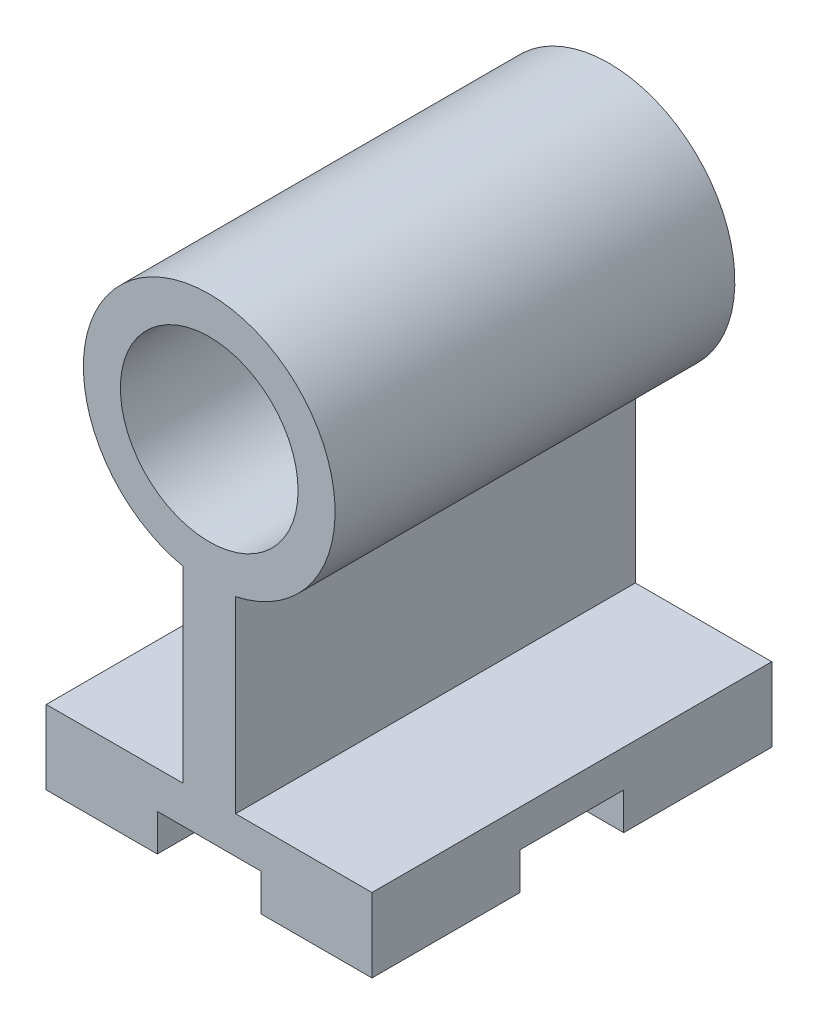
from build123d import *

# Parameters (mm, degrees)
SKETCH1_R           = 12
BOSS_EXTRUDE1_DEPTH = 54
SKETCH2_W           = 14
SKETCH2_H           = 5
CUT_EXTRUDE1_DEPTH  = 44


with BuildPart() as part:
    # Sketch1 → Boss-Extrude1 (new body)
    with BuildSketch(Plane.XY):
        with BuildLine():
            Line((-22, 0), (-7, 0))
            Line((-7, 0), (-7, 5))
            Line((-7, 5), (7, 5))
            Line((7, 5), (7, 0))
            Line((7, 0), (22, 0))
            Line((22, 0), (22, 10))
            Line((22, 10), (3.575995422, 10))
            Line((3.575995422, 10), (3.575995422, 35.405163338))
            ThreePointArc((3.575995422, 35.405163338), (0.016529647, 69.028346048), (-3.542936129, 35.405163338))
            Line((-3.542936129, 35.405163338), (-3.542936129, 10.023734162))
            Line((-3.542936129, 10.023734162), (-22, 10))
            Line((-22, 10), (-22, 0))
        make_face()
        with Locations((0.016529647, 52.028346048)):
            Circle(SKETCH1_R, mode=Mode.SUBTRACT)
    extrude(amount=-BOSS_EXTRUDE1_DEPTH)

    # Sketch2 → Cut-Extrude1 (cut)
    with BuildSketch(Plane(origin=(22, 0, 0), x_dir=(0, 0, -1), z_dir=(1, 0, 0))):
        with Locations((27, 2.5)):
            Rectangle(SKETCH2_W, SKETCH2_H)
    extrude(amount=-CUT_EXTRUDE1_DEPTH, mode=Mode.SUBTRACT)


solid = part.part
